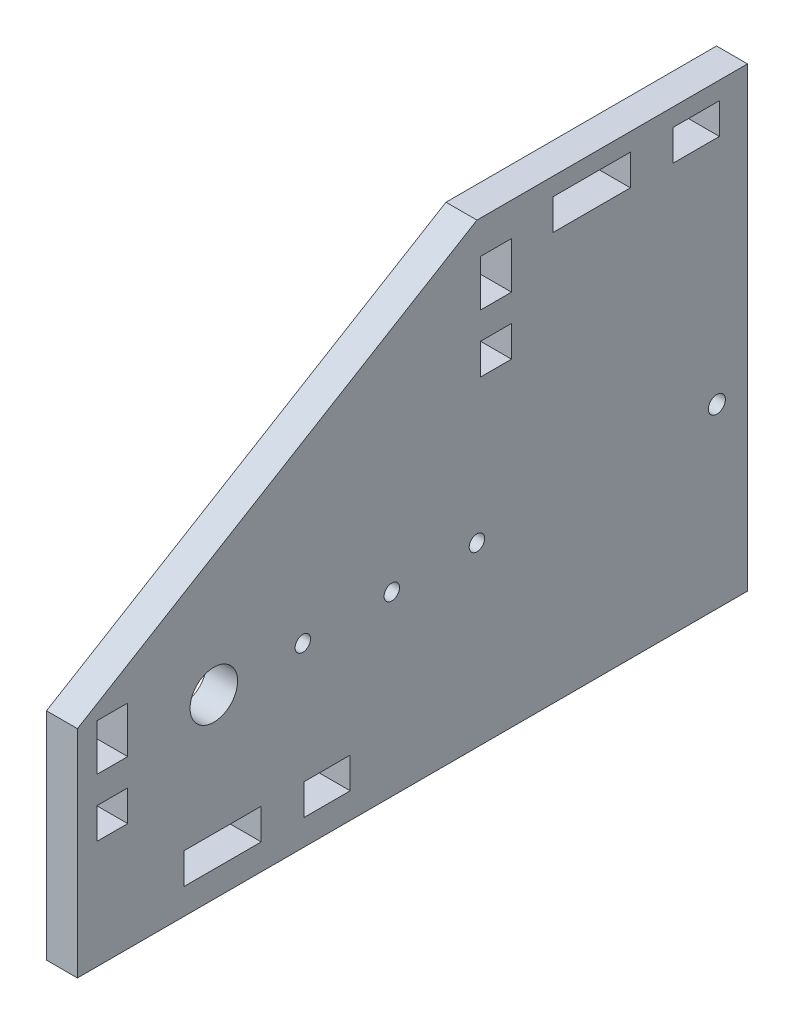
from build123d import *

# Parameters (mm, degrees)
SKETCH1_R           = 3.075
SKETCH1_R_2         = 1
SKETCH1_R_3         = 1.1
SKETCH1_W           = 10
SKETCH1_H           = 4
SKETCH1_W_2         = 4
SKETCH1_H_2         = 6
SKETCH1_W_3         = 6
BOSS_EXTRUDE1_DEPTH = 4


with BuildPart() as part:
    # Sketch1 → Boss-Extrude1 (new body)
    with BuildSketch(Plane(origin=(0, 0, 0), x_dir=(0, 0, -1), z_dir=(1, 0, 0))):
        Polygon((-45.126561274, -21.465862465), (41.462435166, -21.465862465), (41.462435166, 37.538855), (6.497816801, 37.538855), (-45.126561274, 6.437068625), align=None)
        with Locations((-27.502183199, 1.424311927)):
            Circle(SKETCH1_R, mode=Mode.SUBTRACT)
        with Locations((-16.002183199, 1.424311927)):
            Circle(SKETCH1_R_2, mode=Mode.SUBTRACT)
        with Locations((-4.502183199, 1.424311927)):
            Circle(SKETCH1_R_2, mode=Mode.SUBTRACT)
        with Locations((6.497816801, 1.424311927)):
            Circle(SKETCH1_R_2, mode=Mode.SUBTRACT)
        with Locations((37.497816801, 1.424311927)):
            Circle(SKETCH1_R_3, mode=Mode.SUBTRACT)
        with Locations((21.33035671, 33.233983224)):
            Rectangle(SKETCH1_W, SKETCH1_H, mode=Mode.SUBTRACT)
        with Locations((-40.626561274, 3.062484248)):
            Rectangle(SKETCH1_W_2, SKETCH1_H_2, mode=Mode.SUBTRACT)
        with Locations((-40.626561274, -5.437515752)):
            Rectangle(SKETCH1_W_2, SKETCH1_H, mode=Mode.SUBTRACT)
        with Locations((-26.374737007, -16.111091518)):
            Rectangle(SKETCH1_W, SKETCH1_H, mode=Mode.SUBTRACT)
        with Locations((-12.874826786, -16.142516965)):
            Rectangle(SKETCH1_W_3, SKETCH1_H, mode=Mode.SUBTRACT)
        with Locations((34.83035671, 33.233983224)):
            Rectangle(SKETCH1_W_3, SKETCH1_H, mode=Mode.SUBTRACT)
        with Locations((8.963743124, 30.24228943)):
            Rectangle(SKETCH1_W_2, SKETCH1_H_2, mode=Mode.SUBTRACT)
        with Locations((8.963743124, 21.74228943)):
            Rectangle(SKETCH1_W_2, SKETCH1_H, mode=Mode.SUBTRACT)
    extrude(amount=BOSS_EXTRUDE1_DEPTH)


solid = part.part
